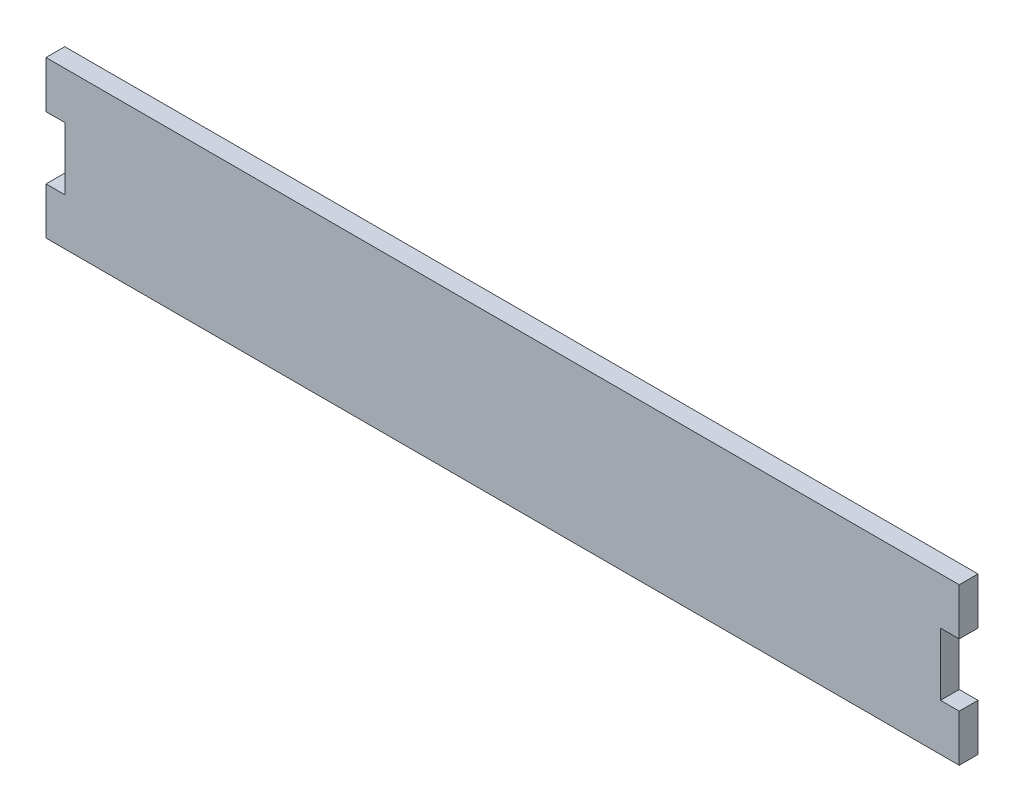
from build123d import *

# Parameters (mm, degrees)
ESBO_O1_W                = 292
ESBO_O1_H                = 50
RESSALTO_EXTRUS_O1_DEPTH = 6
ESBO_O2_W                = 6
ESBO_O2_H                = 20
CORTE_EXTRUS_O1_DEPTH    = 297.310647801


with BuildPart() as part:
    # Esboço1 → Ressalto-extrusão1 (new body)
    with BuildSketch(Plane.XY):
        with Locations((146, 25)):
            Rectangle(ESBO_O1_W, ESBO_O1_H)
    extrude(amount=RESSALTO_EXTRUS_O1_DEPTH)

    # Esboço2 → Corte-extrusão1 (cut, through all)
    with BuildSketch(Plane(origin=(0, 0, 0), x_dir=(-1, 0, 0), z_dir=(0, 0, -1))):
        with Locations((-3, 25)):
            Rectangle(ESBO_O2_W, ESBO_O2_H)
        with Locations((-289, 25)):
            Rectangle(ESBO_O2_W, ESBO_O2_H)
    extrude(amount=-CORTE_EXTRUS_O1_DEPTH, mode=Mode.SUBTRACT)


solid = part.part
